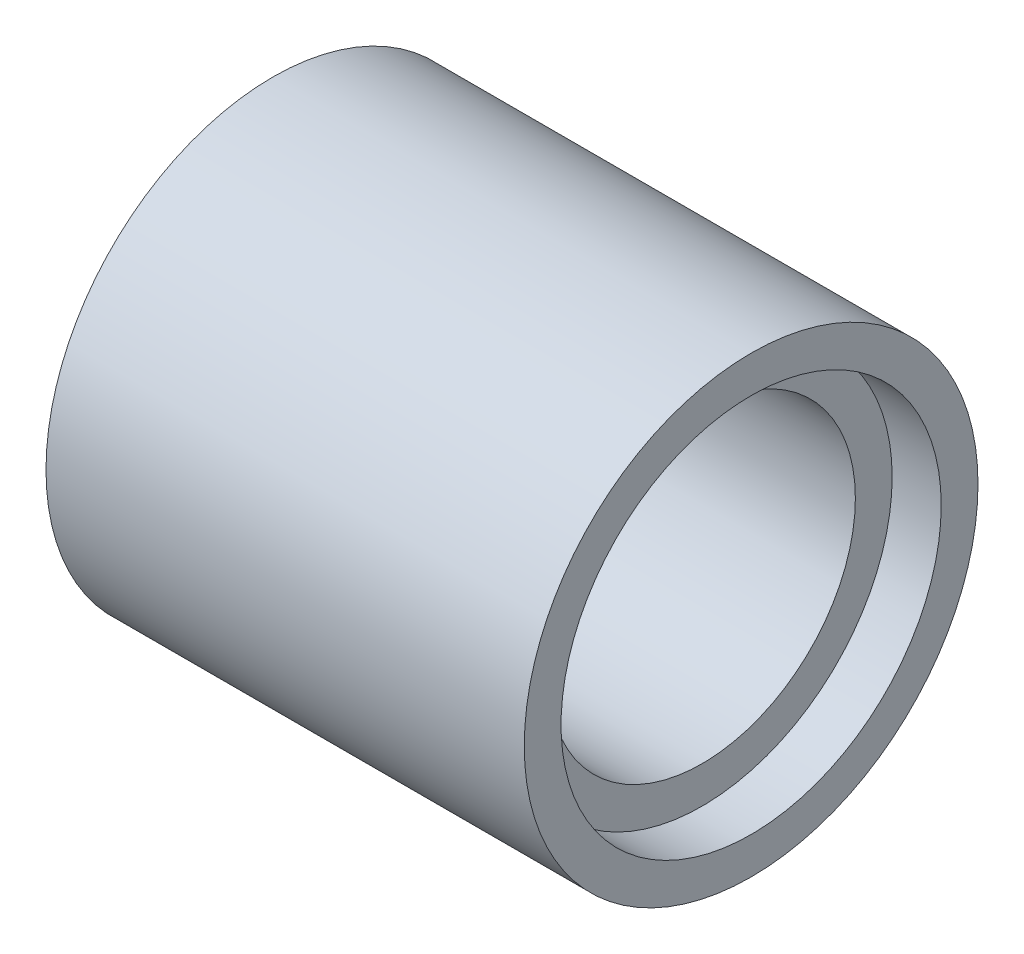
from build123d import *

# Parameters (mm, degrees)
SKETCH_1_R          = 3.7
EXTRUDE_1_DEPTH     = 3.9
SKETCH_2_R          = 2.5
CUT_EXTRUDE_1_DEPTH = 10.392550239
SKETCH_2_3_R        = 3.1
SKETCH_2_3_R_2      = 2.5
CUT_EXTRUDE_2_DEPTH = 0.8


with BuildPart() as part:
    # 草图1 → 凸台-拉伸1 (new, symmetric)
    with BuildSketch(Plane(origin=(0, 0, 0), x_dir=(0, 0, -1), z_dir=(1, 0, 0))):
        Circle(SKETCH_1_R)
    extrude(amount=EXTRUDE_1_DEPTH, both=True)

    # 草图2 → 切除-拉伸1 (cut, through all)
    with BuildSketch(Plane(origin=(3.9, 0, 0), x_dir=(0, 0, -1), z_dir=(1, 0, 0))):
        Circle(SKETCH_2_R)
    extrude(amount=-CUT_EXTRUDE_1_DEPTH, mode=Mode.SUBTRACT)

    # 草图2<3> → 切除-拉伸2 (cut)
    with BuildSketch(Plane(origin=(3.9, 0, 0), x_dir=(0, 0, -1), z_dir=(1, 0, 0))):
        Circle(SKETCH_2_3_R)
        Circle(SKETCH_2_3_R_2, mode=Mode.SUBTRACT)
    cut_extrude_2 = extrude(amount=-CUT_EXTRUDE_2_DEPTH, mode=Mode.SUBTRACT)

    # 镜向1: 切除-拉伸2 across plane
    add(cut_extrude_2.mirror(Plane(origin=(0, 0, 0), x_dir=(0, 0, 1), z_dir=(1, 0, 0))), mode=Mode.SUBTRACT)


solid = part.part
